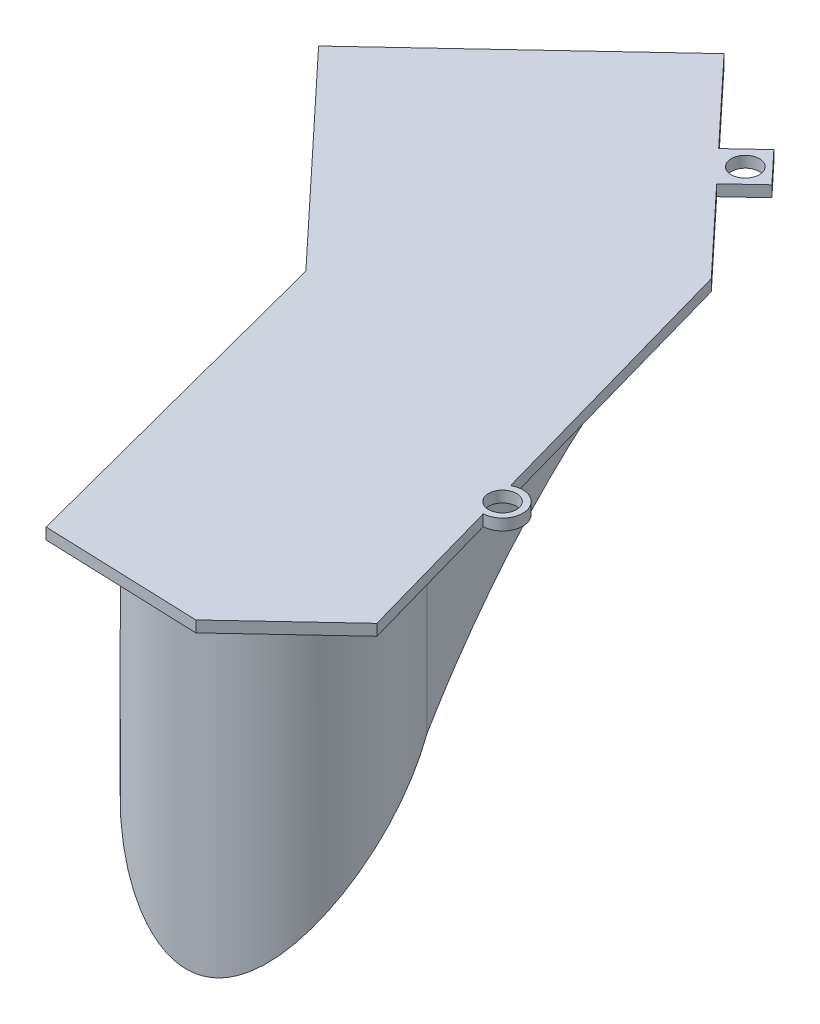
from build123d import *

# Parameters (mm, degrees)
SKETCH3_R               = 3.175
BOSS_EXTRUDE1_DEPTH     = 2.54
BOSS_EXTRUDE2_DEPTH     = 76.2
CUT_EXTRUDE1_DEPTH      = 159.608869597
CUT_EXTRUDE1_DEPTH_BACK = 159.608869597


with BuildPart() as part:
    # Sketch3 → Boss-Extrude1 (new body)
    with BuildSketch(Plane(origin=(0, 0, 0), x_dir=(1, 0, 0), z_dir=(0, 1, 0))):
        with BuildLine():
            Line((-0.667272367, 91.211244064), (42.072585982, 45.579833776))
            Line((42.072585982, 45.579833776), (62.900199296, -34.141504839))
            Line((62.900199296, -34.141504839), (98.113451188, -35.418279698))
            Line((98.113451188, -35.418279698), (119.317385982, -15.557986891))
            Line((119.317385982, -15.557986891), (109.850299083, 18.019409705))
            ThreePointArc((109.850299083, 18.019409705), (114.061816463, 23.863253473), (107.41792498, 26.646434133))
            Line((107.41792498, 26.646434133), (89.543483254, 90.042621912))
            Line((89.543483254, 90.042621912), (71.515910096, 109.289844975))
            Line((71.515910096, 109.289844975), (77.978605526, 115.34301505))
            Line((77.978605526, 115.34301505), (71.293896806, 122.479975678))
            Line((71.293896806, 122.479975678), (64.831201375, 116.426805602))
            Line((64.831201375, 116.426805602), (46.803628217, 135.674028665))
            Line((46.803628217, 135.674028665), (-0.667272367, 91.211244064))
        make_face()
        with Locations(Location((71.405004975, 115.88499878, 0), (0, 0, 270))):
            Circle(SKETCH3_R, mode=Mode.SUBTRACT)
        with Locations(Location((109.633944273, 22.61482283, 0), (0, 0, 270))):
            Circle(SKETCH3_R, mode=Mode.SUBTRACT)
    extrude(amount=BOSS_EXTRUDE1_DEPTH)

    # Sketch4 → Boss-Extrude2 (add)
    with BuildSketch(Plane(origin=(0, 2.54, 0), x_dir=(1, 0, 0), z_dir=(0, 1, 0))):
        with BuildLine():
            Line((46.803628217, 129.736619854), (5.454929405, 91.008087929))
            Line((5.454929405, 91.008087929), (46.353114934, 47.342948269))
            Line((46.353114934, 47.342948269), (61.1366863, -10.500532511))
            ThreePointArc((61.1366863, -10.500532511), (94.212402493, -28.283463558), (108.844487247, 6.301760657))
            Line((108.844487247, 6.301760657), (86.410796294, 87.200194916))
            Line((86.410796294, 87.200194916), (46.803628217, 129.736619854))
        make_face()
    extrude(amount=-BOSS_EXTRUDE2_DEPTH)

    # Sketch14 → Cut-Extrude1 (cut, two sides: drawn at the far end of the back side and taken through both)
    with BuildSketch(Plane(origin=(50.531559178, 0, -13.201631997), x_dir=(0.25277120811930814, 0, 0.9675260804473983), z_dir=(-0.9675260804473983, 0, 0.25277120811930814)).offset(-CUT_EXTRUDE1_DEPTH_BACK)):
        with BuildLine():
            Line((-119.586340422, -76.2), (-7.964682874, -76.2))
            Line((-7.964682874, -76.2), (52.762632555, -76.2))
            ThreePointArc((52.762632555, -76.2), (9.204123856, -25.310156709), (-52.816161516, 0))
            Line((-52.816161516, 0), (-119.586340422, 0))
            Line((-119.586340422, 0), (-119.586340422, -76.2))
        make_face()
    extrude(amount=CUT_EXTRUDE1_DEPTH + CUT_EXTRUDE1_DEPTH_BACK, mode=Mode.SUBTRACT)


solid = part.part
